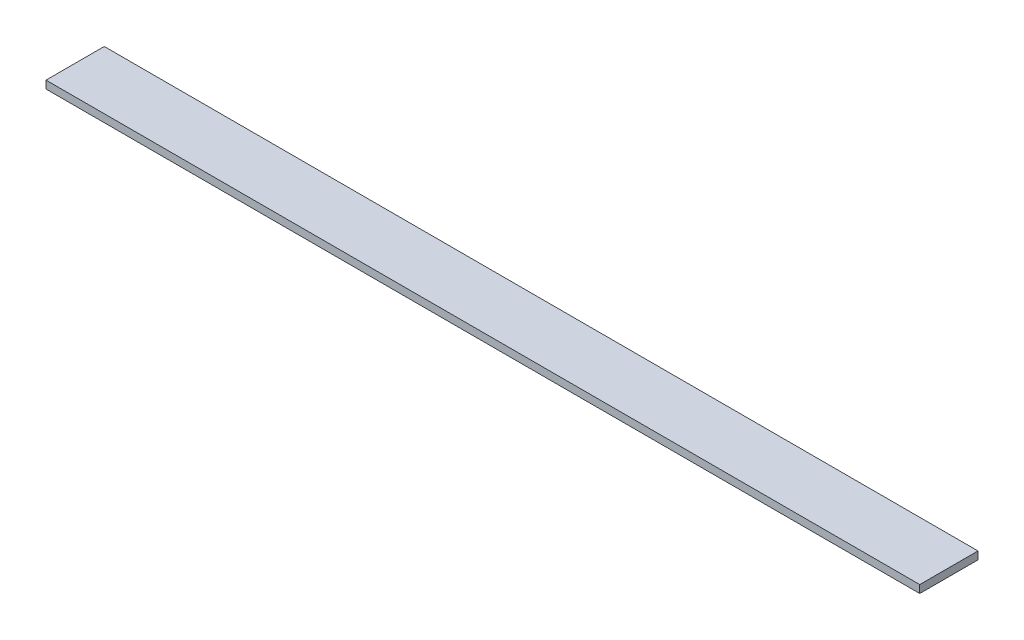
from build123d import *

# Parameters (mm, degrees)
SKETCH_1_W      = 450
SKETCH_1_H      = 30
EXTRUDE_1_DEPTH = 4


with BuildPart() as part:
    # 草圖1 → 填料-伸長1 (new body)
    with BuildSketch(Plane(origin=(0, 0, 0), x_dir=(1, 0, 0), z_dir=(0, 1, 0))):
        with Locations((225, 15)):
            Rectangle(SKETCH_1_W, SKETCH_1_H)
    extrude(amount=EXTRUDE_1_DEPTH)


solid = part.part
